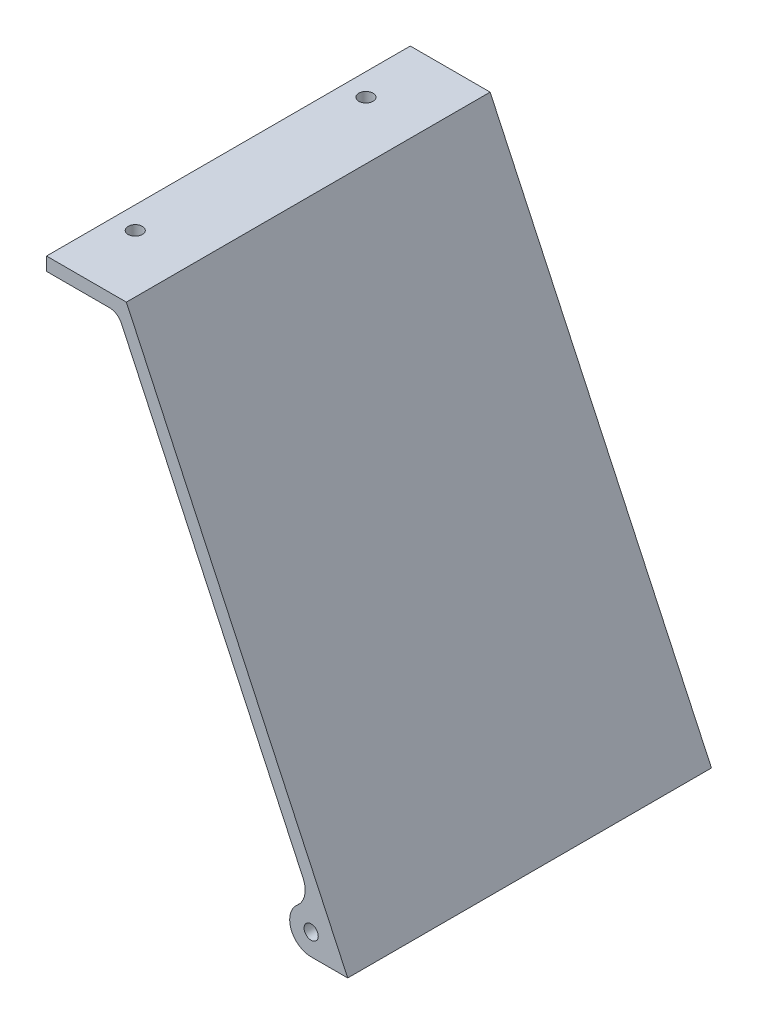
from build123d import *

# Parameters (mm, degrees)
EXTRUDE_1_DEPTH     = 82
SKETCH_4_R          = 1.6
CUT_EXTRUDE_1_DEPTH = 10
FILLET_1_R          = 3
SKETCH_5_R          = 1.6
EXTRUDE_2_DEPTH     = 5
EXTRUDE_START       = -5
SKETCH_6_R          = 1.6
EXTRUDE_3_DEPTH     = 5
SKETCH_7_W          = 5.946088912
SKETCH_7_H          = 0.873329624
CUT_EXTRUDE_2_DEPTH = 115.290435775


with BuildPart() as part:
    # 草图1 → 凸台-拉伸1 (new body)
    with BuildSketch(Plane.XY):
        Polygon((25.726329851, -61.543566927), (30.579717439, -71.951690196), (33.889851195, -71.951690196), (-16.077235621, 35.20307328), (-34.077235621, 35.20307328), (-34.077235621, 32.20307328), (-17.988446404, 32.20307328), align=None)
    extrude(amount=EXTRUDE_1_DEPTH)

    # 草图4 → 切除-拉伸1 (cut)
    with BuildSketch(Plane.XZ.offset(-32.20307328)):
        with Locations(Location((-29.077235621, 67, 0), (0, 0, 270))):
            Circle(SKETCH_4_R)
        with Locations(Location((-29.077235621, 15, 0), (0, 0, 270))):
            Circle(SKETCH_4_R)
    extrude(amount=-CUT_EXTRUDE_1_DEPTH, mode=Mode.SUBTRACT)

    # 圆角1
    fillet_1_edges = [part.edges().sort_by_distance(p)[0] for p in [
        (-17.988446404, 32.20307328, 41),
    ]]
    fillet(fillet_1_edges, radius=FILLET_1_R)

    # 草图5 → 凸台-拉伸2 (add)
    with BuildSketch(Plane(origin=(0, 0, 0), x_dir=(-1, 0, 0), z_dir=(0, 0, -1))):
        with BuildLine():
            Line((-25.579717439, -71.79692672), (-30.507550044, -71.79692672))
            Line((-30.507550044, -71.79692672), (-23.756384483, -57.319005451))
            ThreePointArc((-23.756384483, -57.319005451), (-24.108220381, -60.505712257), (-22.452229611, -63.250996092))
            ThreePointArc((-22.452229611, -63.250996092), (-21.029604517, -68.616859667), (-25.579717439, -71.79692672))
        make_face()
        with Locations((-25.579717439, -66.951690196)):
            Circle(SKETCH_5_R, mode=Mode.SUBTRACT)
    extrude(amount=-EXTRUDE_2_DEPTH)

    # 草图6 → 凸台-拉伸3 (add)
    with BuildSketch(Plane.XY.offset(82).offset(EXTRUDE_START)):
        with BuildLine():
            Line((25.579717439, -71.79692672), (30.507550044, -71.79692672))
            Line((30.507550044, -71.79692672), (23.756384483, -57.319005451))
            ThreePointArc((23.756384483, -57.319005451), (24.108220381, -60.505712257), (22.452229611, -63.250996092))
            ThreePointArc((22.452229611, -63.250996092), (21.029604517, -68.616859667), (25.579717439, -71.79692672))
        make_face()
        with Locations(Location((25.579717439, -66.951690196, 0), (0, 0, 180))):
            Circle(SKETCH_6_R, mode=Mode.SUBTRACT)
    extrude(amount=EXTRUDE_3_DEPTH)

    # 草图7 → 切除-拉伸2 (cut, through all)
    with BuildSketch(Plane.XY.offset(82)):
        with Locations((33.4805945, -72.233591532)):
            Rectangle(SKETCH_7_W, SKETCH_7_H)
    extrude(amount=-CUT_EXTRUDE_2_DEPTH, mode=Mode.SUBTRACT)


solid = part.part
